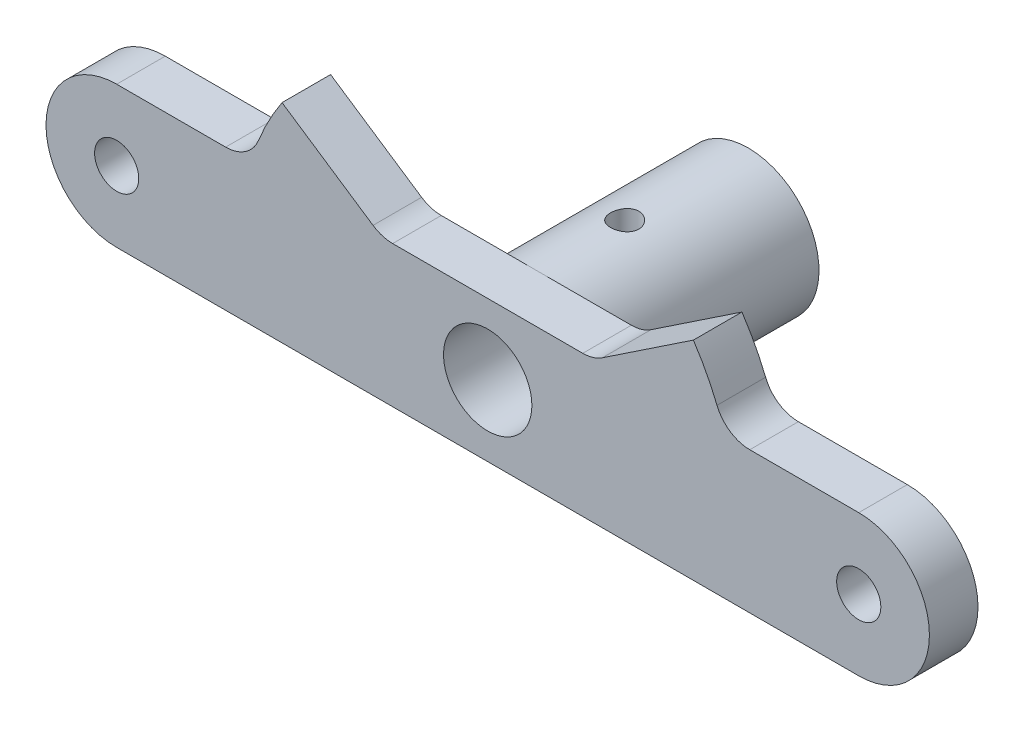
from build123d import *

# Parameters (mm, degrees)
SKETCH_1_W             = 50
SKETCH_1_H             = 8
EXTRUDE_484_DEPTH      = 2.75
SKETCH_6_R             = 4
EXTRUDE_752_DEPTH      = 12
HOLE_WIZARD_M3_D       = 2.5
HOLE_WIZARD_M2_D       = 1.6
EXTRUDE_3073_DEPTH     = 2.75
CUT_EXTRUDE_3452_DEPTH = 2.75
SKETCH_10_R            = 2.5
CUT_EXTRUDE_3895_DEPTH = 31.050948797
FILLET_4_RADIUS        = 4
FILLET_4_LENGTH        = 2.75
FILLET_5_RADIUS        = 4
FILLET_5_LENGTH        = 2.75
FILLET_6_R             = 2


with BuildPart() as part:
    # Эскиз1 → Extrude 484 (new body)
    with BuildSketch(Plane.XY):
        Rectangle(SKETCH_1_W, SKETCH_1_H)
    extrude(amount=EXTRUDE_484_DEPTH)

    # Эскиз6 → Extrude 752 (add)
    with BuildSketch(Plane(origin=(0, 0, 0), x_dir=(-1, 0, 0), z_dir=(0, 0, -1))):
        with Locations(Location((0, 0, 0), (0, 0, 270))):
            Circle(SKETCH_6_R)
    extrude(amount=EXTRUDE_752_DEPTH)

    # Крепление толкателей M3 (through all)
    with Locations(Plane.XY.offset(2.75)):
        with Locations((-21, 0), (21, 0)):
            Hole(HOLE_WIZARD_M3_D / 2)

    # Крепление вала M2 (through all)
    with Locations(Plane(origin=(0, 4, -5), x_dir=(1, 0, 0), z_dir=(0, 1, 0))):
        with Locations((0, 0)):
            Hole(HOLE_WIZARD_M2_D / 2)

    # Эскиз11 → Extrude 3073 (add)
    with BuildSketch(Plane.XY.offset(2.75)):
        with BuildLine():
            Line((-14, 0), (0, 0))
            Line((0, 0), (14, 0))
            ThreePointArc((14, 0), (0, 14), (-14, 0))
        make_face()
    extrude(amount=-EXTRUDE_3073_DEPTH)

    # Эскиз12 → Cut-Extrude 3452 (cut)
    with BuildSketch(Plane.XY.offset(2.75)):
        with BuildLine():
            Line((-5.986423051, 4), (5.986423051, 4))
            Line((5.986423051, 4), (11.640574572, 7.777983262))
            ThreePointArc((11.640574572, 7.777983262), (0, 14), (-11.640574572, 7.777983262))
            Line((-11.640574572, 7.777983262), (-5.986423051, 4))
        make_face()
    extrude(amount=-CUT_EXTRUDE_3452_DEPTH, mode=Mode.SUBTRACT)

    # Эскиз10 → Cut-Extrude 3895 (cut, through all)
    with BuildSketch(Plane.XY.offset(-12)):
        Circle(SKETCH_10_R)
    extrude(amount=CUT_EXTRUDE_3895_DEPTH, mode=Mode.SUBTRACT)

    # Скругление4: full round fillet: the end face becomes a half cylinder, R = half its width
    fillet_4_face = Plane((-25, 0, 1.375), x_dir=(0, 0, 1), z_dir=(-1, 0, 0))  # on the end face: x along it, z out of the body
    fillet_4_slab = fillet_4_face.offset(-FILLET_4_RADIUS / 2) * Box(FILLET_4_LENGTH, 2 * FILLET_4_RADIUS, FILLET_4_RADIUS, mode=Mode.PRIVATE)  # the body's end, R deep
    fillet_4_round = Plane((-21, 0, 1.375), x_dir=(-1, 0, 0), z_dir=(0, 0, 1)) * Cylinder(FILLET_4_RADIUS, FILLET_4_LENGTH, mode=Mode.PRIVATE)  # its axis R under the face
    add(fillet_4_slab - fillet_4_round, mode=Mode.SUBTRACT)

    # Скругление5: full round fillet: the end face becomes a half cylinder, R = half its width
    fillet_5_face = Plane((25, 0, 1.375), x_dir=(0, 0, 1), z_dir=(1, 0, 0))  # on the end face: x along it, z out of the body
    fillet_5_slab = fillet_5_face.offset(-FILLET_5_RADIUS / 2) * Box(FILLET_5_LENGTH, 2 * FILLET_5_RADIUS, FILLET_5_RADIUS, mode=Mode.PRIVATE)  # the body's end, R deep
    fillet_5_round = Plane((21, 0, 1.375), x_dir=(1, 0, 0), z_dir=(0, 0, 1)) * Cylinder(FILLET_5_RADIUS, FILLET_5_LENGTH, mode=Mode.PRIVATE)  # its axis R under the face
    add(fillet_5_slab - fillet_5_round, mode=Mode.SUBTRACT)

    # Скругление6
    fillet_6_edges = [part.edges().sort_by_distance(p)[0] for p in [
        (13.416407865, 4, 1.375),
        (-13.416407865, 4, 1.375),
        (5.986423051, 4, 1.375),
        (-5.986423051, 4, 1.375),
    ]]
    fillet(fillet_6_edges, radius=FILLET_6_R)


solid = part.part
